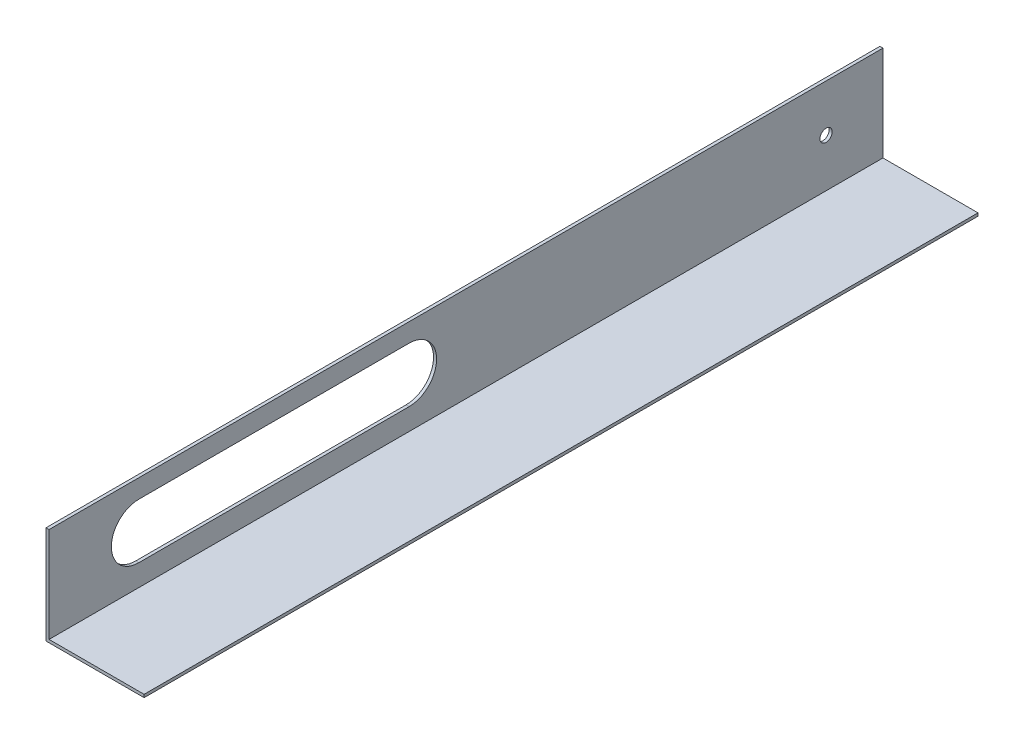
from build123d import *

# Parameters (mm, degrees)
BOSS_EXTRUDE2_DEPTH = 431.8
SKETCH8_R           = 3.175
CUT_EXTRUDE6_DEPTH  = 2.54


with BuildPart() as part:
    # Sketch3 → Boss-Extrude2 (new body)
    with BuildSketch(Plane.XY):
        Polygon((49.2125, 1.5875), (49.2125, 50.8), (50.8, 50.8), (50.8, 1.524), (100.0125, 1.524), (100.0125, 0), (49.2125, 0), align=None)
    extrude(amount=BOSS_EXTRUDE2_DEPTH)

    # Sketch8 → Cut-Extrude6 (cut)
    with BuildSketch(Plane(origin=(50.8, 0, 0), x_dir=(0, 0, -1), z_dir=(1, 0, 0))):
        with Locations((-29.464, 26.416)):
            Circle(SKETCH8_R)
        with BuildLine():
            Line((-245.364, 12.7), (-385.318, 12.7))
            ThreePointArc((-385.318, 12.7), (-399.542, 26.924), (-385.318, 41.148))
            Line((-385.318, 41.148), (-245.364, 41.148))
            ThreePointArc((-245.364, 41.148), (-231.14, 26.924), (-245.364, 12.7))
        make_face()
    extrude(amount=-CUT_EXTRUDE6_DEPTH, mode=Mode.SUBTRACT)


solid = part.part
